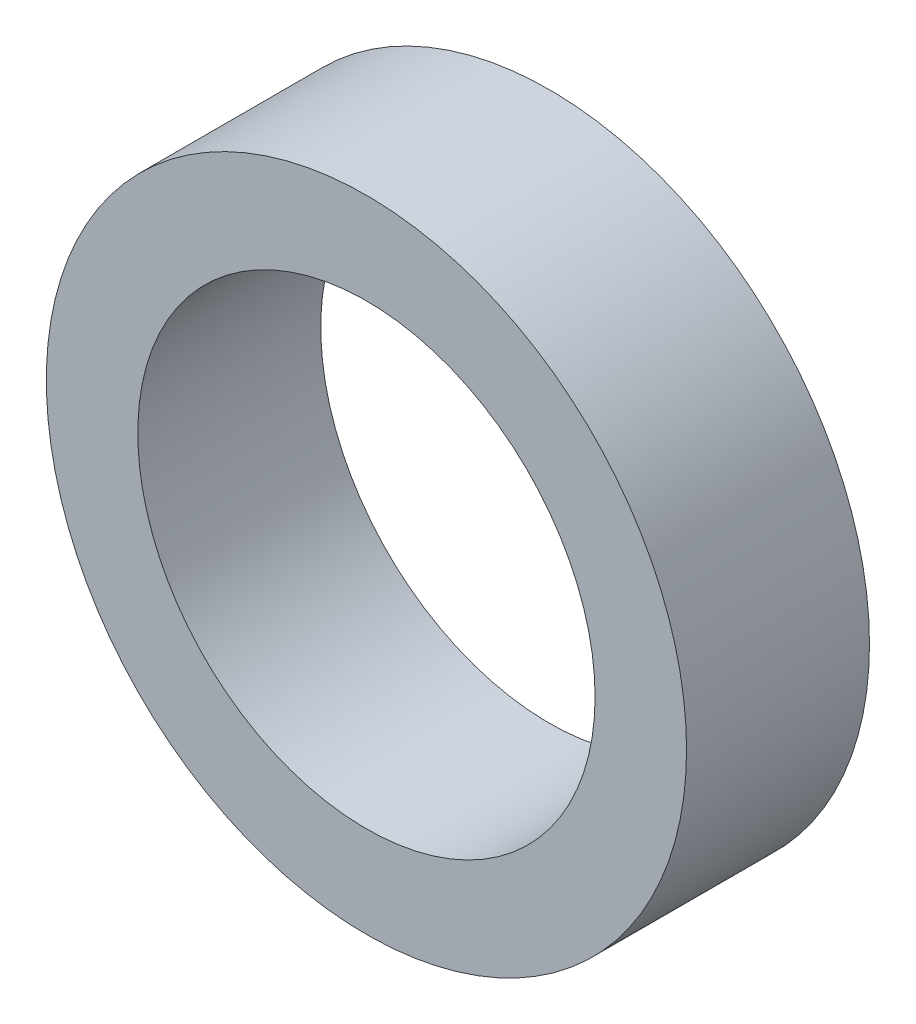
from build123d import *

# Parameters (mm, degrees)
SKETCH1_R           = 88.9
SKETCH1_R_2         = 63.5
BOSS_EXTRUDE1_DEPTH = 25.4


with BuildPart() as part:
    # Sketch1 → Boss-Extrude1 (new, symmetric)
    with BuildSketch(Plane.XY):
        Circle(SKETCH1_R)
        Circle(SKETCH1_R_2, mode=Mode.SUBTRACT)
    extrude(amount=BOSS_EXTRUDE1_DEPTH, both=True)


solid = part.part
